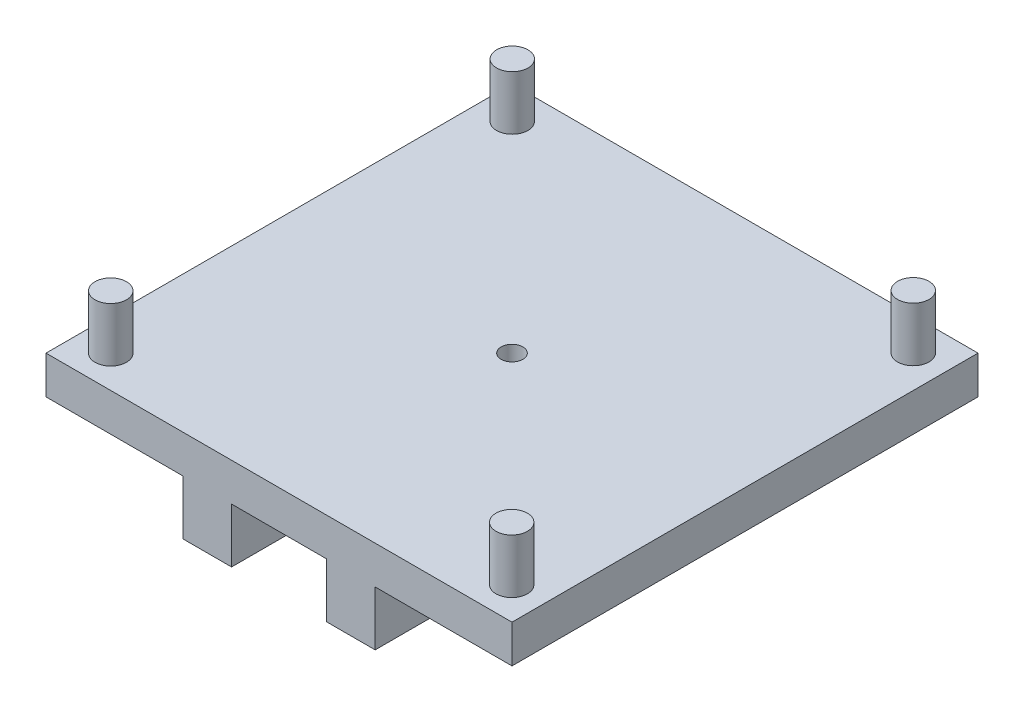
from build123d import *

# Parameters (mm, degrees)
SKETCH1_W                                  = 43
SKETCH1_H                                  = 43
SKETCH1_R                                  = 1
BOSS_EXTRUDE1_DEPTH                        = 3.5
SKETCH3_R                                  = 1.45
BOSS_EXTRUDE2_DEPTH                        = 5
MIRROR2_AT_THE_SECOND_PLANE_COPY_1_SKETC_R = 1.45
MIRROR2_AT_THE_SECOND_PLANE_COPY_1_DEPTH   = 5
SKETCH4_W                                  = 4.5
SKETCH4_H                                  = 43
BOSS_EXTRUDE3_DEPTH                        = 5.03


with BuildPart() as part:
    # Sketch1 → Boss-Extrude1 (new body)
    with BuildSketch(Plane(origin=(0, 0, 0), x_dir=(1, 0, 0), z_dir=(0, 1, 0))):
        Rectangle(SKETCH1_W, SKETCH1_H)
        with Locations(Location((0, 0, 0), (0, 0, 270))):
            Circle(SKETCH1_R, mode=Mode.SUBTRACT)
    extrude(amount=BOSS_EXTRUDE1_DEPTH)

    # Sketch3 → Boss-Extrude2 (add)
    with BuildSketch(Plane(origin=(0, 3.5, 0), x_dir=(1, 0, 0), z_dir=(0, 1, 0))):
        with Locations(Location((-18.5, 18.527041475, 0), (0, 0, 90))):
            Circle(SKETCH3_R)
    boss_extrude2 = extrude(amount=BOSS_EXTRUDE2_DEPTH)

    # Mirror2: Boss-Extrude2 across plane
    add(boss_extrude2.mirror(Plane.XY))

    # Mirror2 at the second plane: Boss-Extrude2 across plane
    add(boss_extrude2.mirror(Plane(origin=(0, 0, 0), x_dir=(0, 0, 1), z_dir=(1, 0, 0))))

    # Mirror2 at the second plane copy 1 sketc → Mirror2 at the second plane copy 1 (add)
    with BuildSketch(Plane(origin=(0, 3.5, 0), x_dir=(-1, 0, 0), z_dir=(0, 1, 0))):
        with Locations(Location((-18.5, 18.527041475, 0), (0, 0, 90))):
            Circle(MIRROR2_AT_THE_SECOND_PLANE_COPY_1_SKETC_R)
    extrude(amount=MIRROR2_AT_THE_SECOND_PLANE_COPY_1_DEPTH)

    # Sketch4 → Boss-Extrude3 (add)
    with BuildSketch(Plane.XZ):
        with Locations((-6.625, 0)):
            Rectangle(SKETCH4_W, SKETCH4_H)
    boss_extrude3 = extrude(amount=BOSS_EXTRUDE3_DEPTH)

    # Mirror3: Boss-Extrude3 across plane
    add(boss_extrude3.mirror(Plane(origin=(0, 0, 0), x_dir=(0, 0, 1), z_dir=(1, 0, 0))))


solid = part.part
